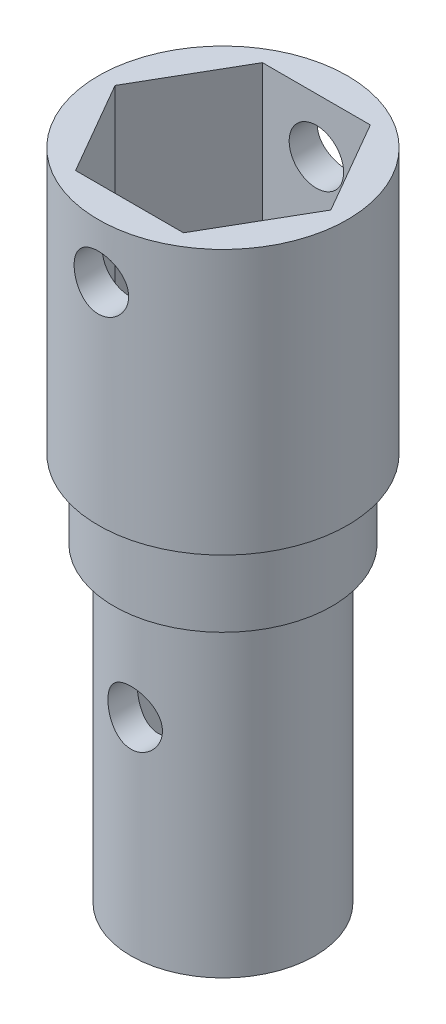
from build123d import *

# Parameters (mm, degrees)
SKETCH1_R               = 8
BOSS_EXTRUDE1_DEPTH     = 17
CUT_EXTRUDE2_DEPTH      = 24.430749028
CUT_EXTRUDE2_DEPTH_BACK = 24.430749028
SKETCH3_R               = 5.900211262
SKETCH3_R_2             = 4.15
BOSS_EXTRUDE2_DEPTH     = 25
CUT_EXTRUDE3_DEPTH      = 28.440845526
CUT_EXTRUDE3_DEPTH_BACK = 28.440845526
SKETCH4_R               = 1.75
SKETCH5_R               = 7
SKETCH5_R_2             = 5.900211262
BOSS_EXTRUDE3_DEPTH     = 5


with BuildPart() as part:
    # Sketch1 → Boss-Extrude1 (new body)
    with BuildSketch(Plane.XZ):
        with Locations(Location((0, 0, 0), (0, 0, 270))):
            Circle(SKETCH1_R)
        Polygon((6.92820323, 0), (3.464101615, 6), (-3.464101615, 6), (-6.92820323, 0), (-3.464101615, -6), (3.464101615, -6), align=None, mode=Mode.SUBTRACT)
    extrude(amount=-BOSS_EXTRUDE1_DEPTH)

    # Sketch2 → Cut-Extrude2 (cut, two sides: drawn at the far end of the back side and taken through both)
    with BuildSketch(Plane.XY.offset(-6).offset(-CUT_EXTRUDE2_DEPTH_BACK)):
        with BuildLine():
            ThreePointArc((-1.75, 13.5), (-1.237436867, 12.262563133), (0, 11.75))
            ThreePointArc((0, 11.75), (1.237436867, 12.262563133), (1.75, 13.5))
            ThreePointArc((1.75, 13.5), (1.237436867, 14.737436867), (0, 15.25))
            ThreePointArc((0, 15.25), (-1.237436867, 14.737436867), (-1.75, 13.5))
        make_face()
    extrude(amount=CUT_EXTRUDE2_DEPTH + CUT_EXTRUDE2_DEPTH_BACK, mode=Mode.SUBTRACT)



with BuildPart() as body_2:
    # Sketch3 → Boss-Extrude2 (new body)
    with BuildSketch(Plane.XZ):
        with Locations(Location((0, 0, 0), (0, 0, 270))):
            Circle(SKETCH3_R)
        with Locations(Location((0, 0, 0), (0, 0, 270))):
            Circle(SKETCH3_R_2, mode=Mode.SUBTRACT)
    extrude(amount=BOSS_EXTRUDE2_DEPTH)

    # Sketch4 → Cut-Extrude3 (cut, two sides: drawn at the far end of the back side and taken through both)
    with BuildSketch(Plane.XY.offset(-CUT_EXTRUDE3_DEPTH_BACK)):
        with Locations((0, -11.75)):
            Circle(SKETCH4_R)
    extrude(amount=CUT_EXTRUDE3_DEPTH + CUT_EXTRUDE3_DEPTH_BACK, mode=Mode.SUBTRACT)


with BuildPart() as part_1:
    add(part.part)

    add(body_2.part)  # Boss-Extrude3 merges body 2
    # Sketch5 → Boss-Extrude3 (add)
    with BuildSketch(Plane.XZ):
        with Locations(Location((0, 0, 0), (0, 0, 270))):
            Circle(SKETCH5_R)
        with Locations(Location((0, 0, 0), (0, 0, 270))):
            Circle(SKETCH5_R_2, mode=Mode.SUBTRACT)
    extrude(amount=BOSS_EXTRUDE3_DEPTH)


solid = part_1.part
